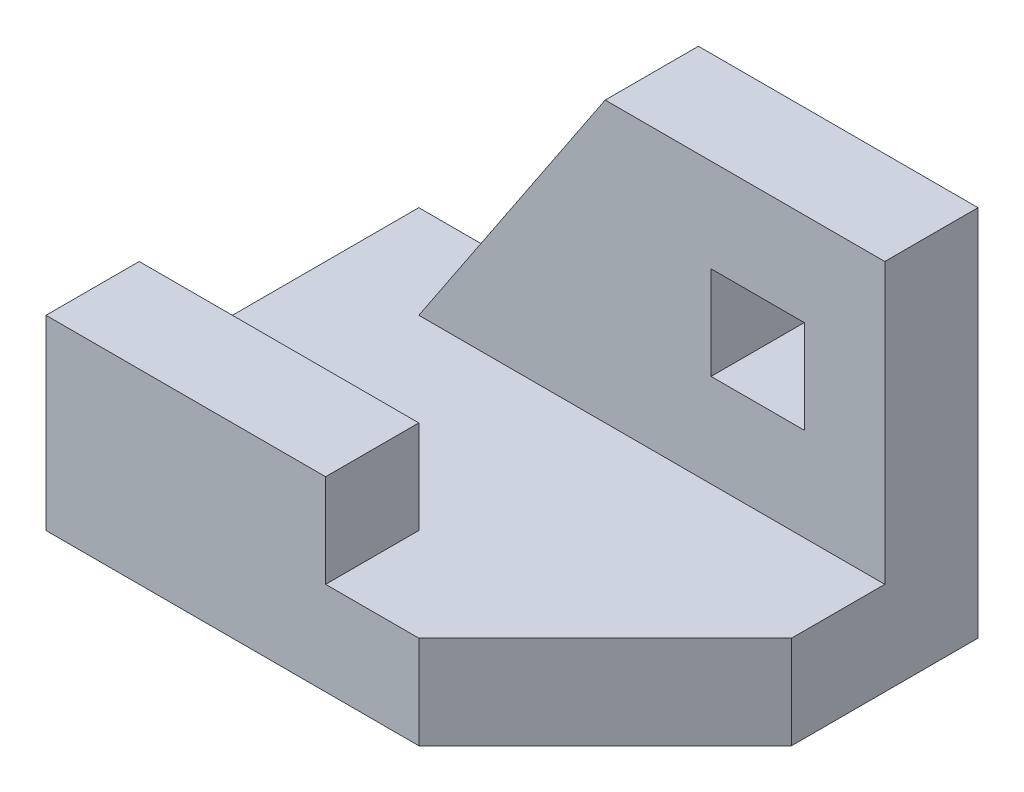
from build123d import *

# Parameters (mm, degrees)
BOSS_EXTRUDE1_DEPTH = 10
SKETCH2_W           = 30
SKETCH2_H           = 10
BOSS_EXTRUDE2_DEPTH = 10
SKETCH3_W           = 10
SKETCH3_H           = 10
BOSS_EXTRUDE3_DEPTH = 10


with BuildPart() as part:
    # Sketch1 → Boss-Extrude1 (new body)
    with BuildSketch(Plane(origin=(0, 0, 0), x_dir=(1, 0, 0), z_dir=(0, 1, 0))):
        Polygon((30, 0), (10, -20), (-30, -20), (-30, 20), (30, 20), align=None)
    extrude(amount=BOSS_EXTRUDE1_DEPTH)

    # Sketch2 → Boss-Extrude2 (add)
    with BuildSketch(Plane.XY.offset(20)):
        with Locations((-15, 15)):
            Rectangle(SKETCH2_W, SKETCH2_H)
    extrude(amount=-BOSS_EXTRUDE2_DEPTH)

    # Sketch3 → Boss-Extrude3 (add)
    with BuildSketch(Plane(origin=(0, 0, -20), x_dir=(-1, 0, 0), z_dir=(0, 0, -1))):
        Polygon((-30, 10), (-30, 40), (0, 40), (20, 10), align=None)
        with Locations((-16.361006702, 25)):
            Rectangle(SKETCH3_W, SKETCH3_H, mode=Mode.SUBTRACT)
    extrude(amount=-BOSS_EXTRUDE3_DEPTH)


solid = part.part
